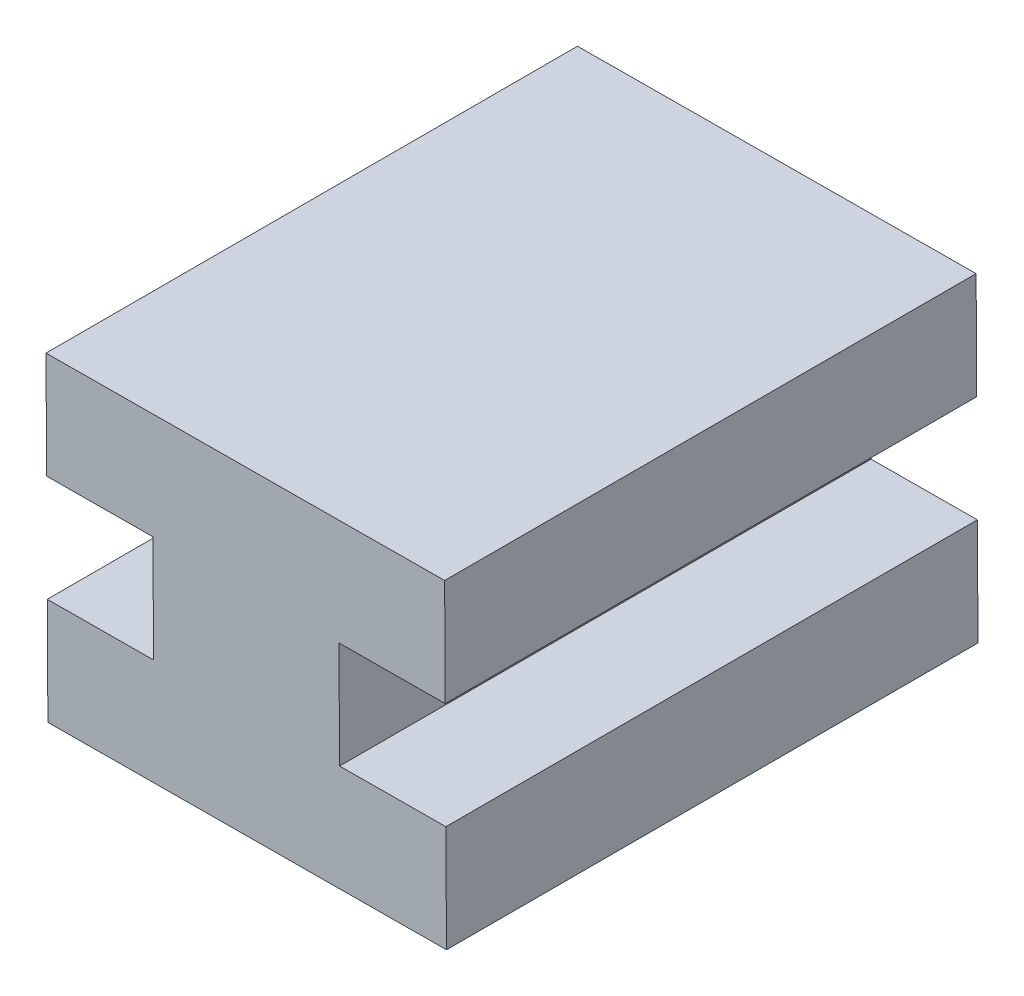
from build123d import *

# Parameters (mm, degrees)
BOSS_EXTRUDE1_DEPTH      = 10
BOSS_EXTRUDE1_DEPTH_BACK = 10


with BuildPart() as part:
    # Sketch1 → Boss-Extrude1 (new, two sides: drawn at the far end of the back side and taken through both)
    with BuildSketch(Plane.XY.offset(-BOSS_EXTRUDE1_DEPTH_BACK)):
        Polygon((7.274522478, 125.455869207), (22.274260332, 125.544550227), (22.25061206, 129.544480321), (18.250681966, 129.520832049), (18.227033694, 133.520762144), (22.226963788, 133.544410415), (22.203315516, 137.54434051), (7.203577663, 137.45565949), (7.227225935, 133.455729396), (11.227156029, 133.479377668), (11.250804301, 129.479447574), (7.250874206, 129.455799302), align=None)
    extrude(amount=BOSS_EXTRUDE1_DEPTH + BOSS_EXTRUDE1_DEPTH_BACK)


solid = part.part
